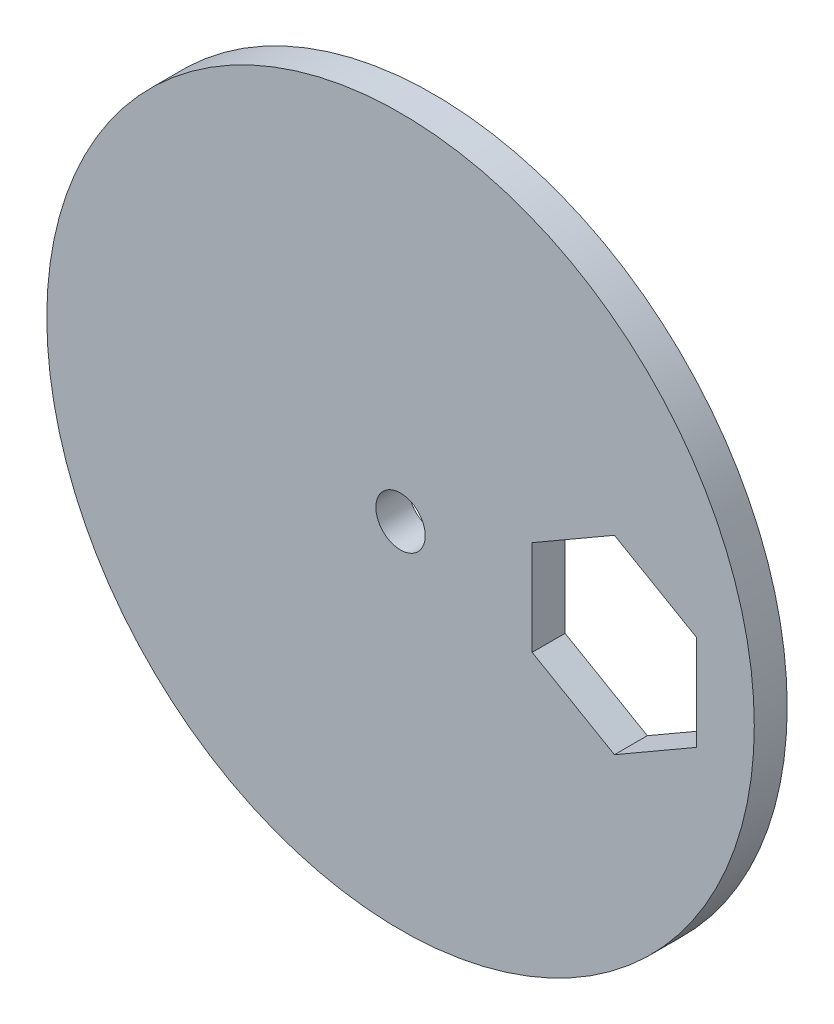
from build123d import *

# Parameters (mm, degrees)
SKETCH1_R           = 21.5
SKETCH1_R_2         = 1.5
BOSS_EXTRUDE1_DEPTH = 2


with BuildPart() as part:
    # Sketch1 → Boss-Extrude1 (new body)
    with BuildSketch(Plane.XY):
        Circle(SKETCH1_R)
        Circle(SKETCH1_R_2, mode=Mode.SUBTRACT)
        Polygon((18, 2.886751346), (13, 5.773502692), (8, 2.886751346), (8, -2.886751346), (13, -5.773502692), (18, -2.886751346), align=None, mode=Mode.SUBTRACT)
    extrude(amount=BOSS_EXTRUDE1_DEPTH)


solid = part.part
